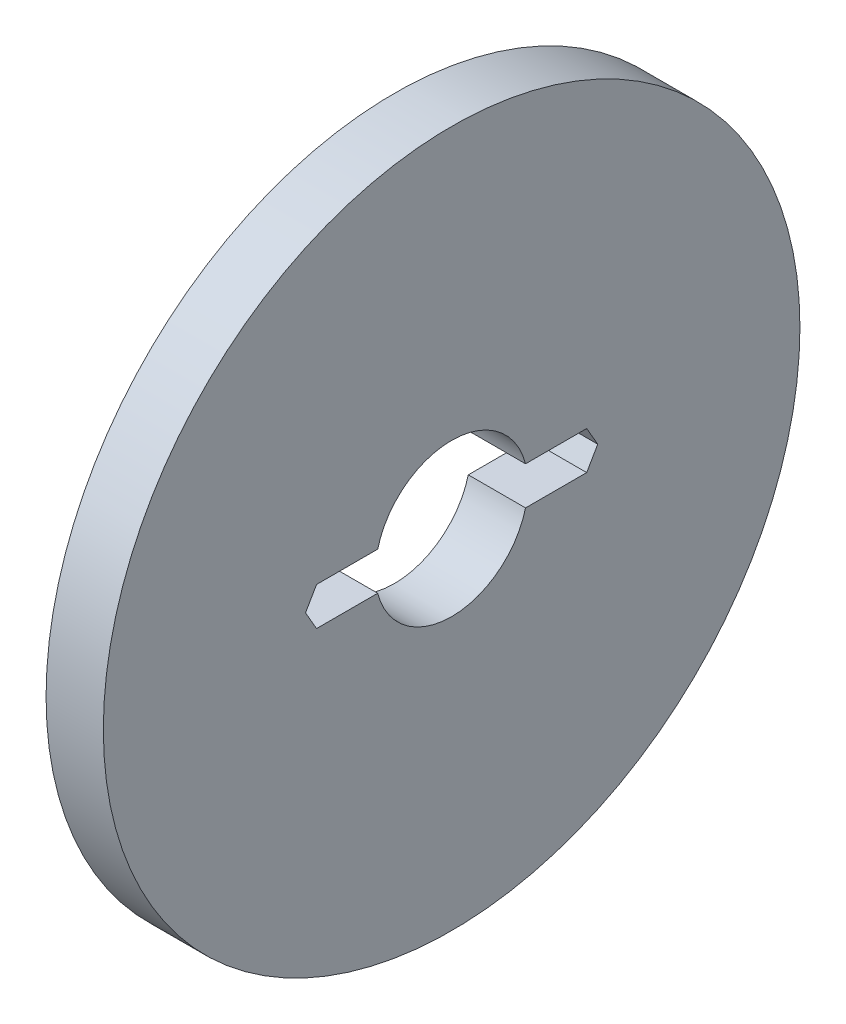
from build123d import *

# Parameters (mm, degrees)
SKETCH1_R           = 18.25
BOSS_EXTRUDE1_DEPTH = 3


with BuildPart() as part:
    # Sketch1 → Boss-Extrude1 (new body)
    with BuildSketch(Plane(origin=(0, 0, 0), x_dir=(0, 0, -1), z_dir=(1, 0, 0))):
        Circle(SKETCH1_R)
        with BuildLine():
            Line((5.922649731, 1), (3.872983346, 1))
            ThreePointArc((3.872983346, 1), (0, 4), (-3.872983346, 1))
            Line((-3.872983346, 1), (-5.922649731, 1))
            Line((-5.922649731, 1), (-7.077350269, 1))
            Line((-7.077350269, 1), (-7.654700538, 0))
            Line((-7.654700538, 0), (-7.077350269, -1))
            Line((-7.077350269, -1), (-5.922649731, -1))
            Line((-5.922649731, -1), (-3.872983346, -1))
            ThreePointArc((-3.872983346, -1), (0, -4), (3.872983346, -1))
            Line((3.872983346, -1), (5.922649731, -1))
            Line((5.922649731, -1), (6.5, -1))
            Line((6.5, -1), (7.077350269, -1))
            Line((7.077350269, -1), (7.654700538, 0))
            Line((7.654700538, 0), (7.077350269, 1))
            Line((7.077350269, 1), (6.5, 1))
            Line((6.5, 1), (5.922649731, 1))
        make_face(mode=Mode.SUBTRACT)
    extrude(amount=BOSS_EXTRUDE1_DEPTH)


solid = part.part
